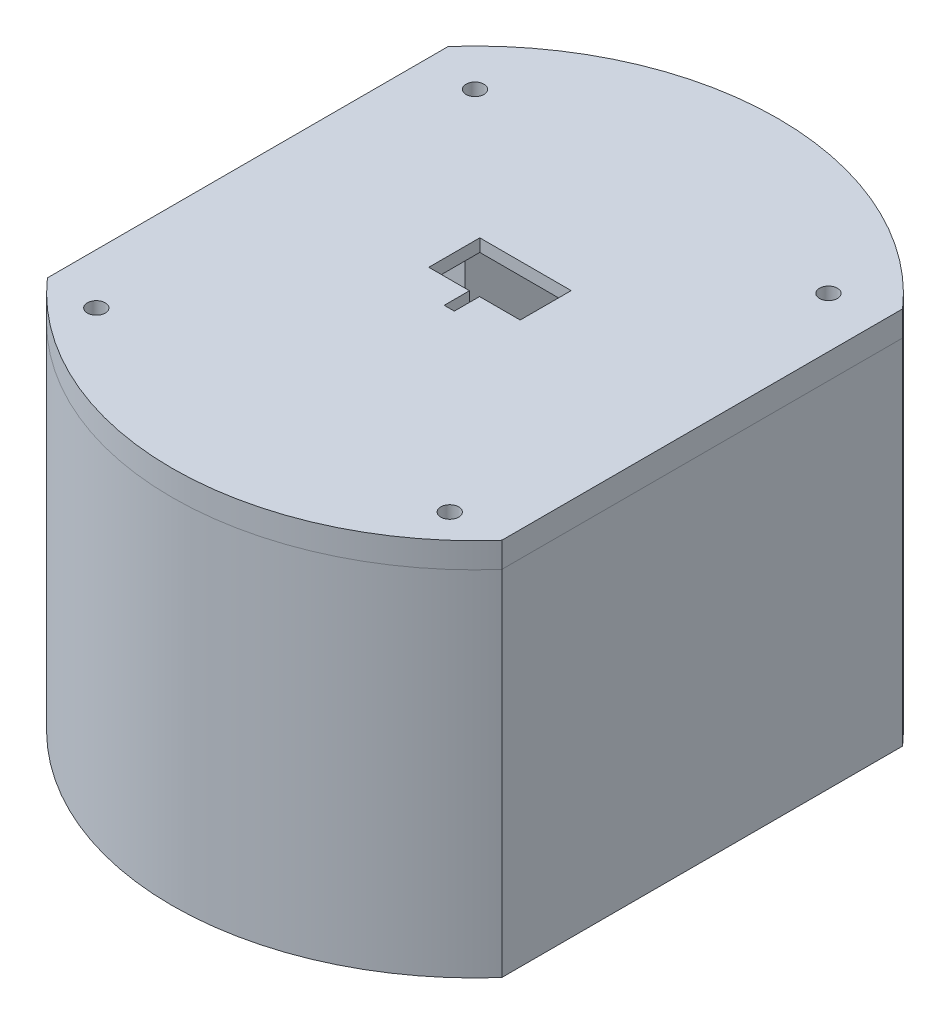
from build123d import *

# Parameters (mm, degrees)
SKETCH1_R                = 76.2
BOSS_EXTRUDE1_DEPTH      = 88.9
CUT_EXTRUDE1_DEPTH       = 38.1
SKETCH3_W                = 81.28
SKETCH3_H                = 87.619747847
CUT_EXTRUDE2_DEPTH       = 71.12
CUT_EXTRUDE4_DEPTH       = 140.7
CUT_EXTRUDE6_REACH       = 132.291
SKETCH6_W                = 100.33
SKETCH6_H                = 82.55
SKETCH7_W                = 9.525
SKETCH7_H                = 15.823137595
CUT_EXTRUDE7_DEPTH       = 13.716
M4_CLEARANCE_HOLE1_D     = 4.5
M4_CLEARANCE_HOLE1_DEPTH = 25.4
M4_CLEARANCE_HOLE1_TIP   = 1.351936393
SKETCH11_R               = 2.25
BOSS_EXTRUDE2_DEPTH      = 6.35
CUT_EXTRUDE8_DEPTH       = 13.716
SKETCH13_W               = 100.33
SKETCH13_H               = 82.55
CUT_EXTRUDE9_DEPTH       = 3.175


with BuildPart() as part:
    # Sketch1 → Boss-Extrude1 (new body)
    with BuildSketch(Plane(origin=(0, 0, 0), x_dir=(1, 0, 0), z_dir=(0, 1, 0))):
        with Locations(Location((0, 0, 0), (0, 0, 270))):
            Circle(SKETCH1_R)
    extrude(amount=BOSS_EXTRUDE1_DEPTH)

    # Sketch2 → Cut-Extrude1 (cut)
    with BuildSketch(Plane(origin=(0, 88.9, 0), x_dir=(1, 0, 0), z_dir=(0, 1, 0))):
        with BuildLine():
            Line((38.1, -58.544107304), (38.1, 58.544107304))
            ThreePointArc((38.1, 58.544107304), (0, 69.85), (-38.1, 58.544107304))
            Line((-38.1, 58.544107304), (-38.1, -58.544107304))
            ThreePointArc((-38.1, -58.544107304), (0, -69.85), (38.1, -58.544107304))
        make_face()
    extrude(amount=-CUT_EXTRUDE1_DEPTH, mode=Mode.SUBTRACT)

    # Sketch3 → Cut-Extrude2 (cut)
    with BuildSketch(Plane.XZ):
        with Locations((0, -20.648099982)):
            Rectangle(SKETCH3_W, SKETCH3_H)
        with BuildLine():
            Line((40.64, -64.457973905), (-40.64, -64.457973905))
            ThreePointArc((-40.64, -64.457973905), (0, -76.2), (40.64, -64.457973905))
        make_face()
    extrude(amount=-CUT_EXTRUDE2_DEPTH, mode=Mode.SUBTRACT)

    # Sketch5 → Cut-Extrude4 (cut, through all)
    with BuildSketch(Plane(origin=(0, 88.9, 0), x_dir=(1, 0, 0), z_dir=(0, 1, 0))):
        with BuildLine():
            Line((-57.15, 50.401562476), (-57.15, -50.401562476))
            ThreePointArc((-57.15, -50.401562476), (-76.2, 0), (-57.15, 50.401562476))
        make_face()
        with BuildLine():
            Line((57.15, 50.401562476), (57.15, -50.401562476))
            ThreePointArc((57.15, -50.401562476), (76.2, 0), (57.15, 50.401562476))
        make_face()
    extrude(amount=-CUT_EXTRUDE4_DEPTH, mode=Mode.SUBTRACT)

    # Cut-Extrude6: up to this face of the body (flat: up to its plane)
    cut_extrude6_end = Plane(part.part.faces().sort_by_distance((0, 50.8, 44.815572864))[0])
    # Sketch6 → Cut-Extrude6 (cut, up to the picked face)
    with BuildSketch(Plane(origin=(0, 88.9, 0), x_dir=(1, 0, 0), z_dir=(0, 1, 0)), mode=Mode.PRIVATE) as cut_extrude6_sk1:
        with Locations((0, -3.175)):
            Rectangle(SKETCH6_W, SKETCH6_H)
    cut_extrude6_tool1 = split(extrude(cut_extrude6_sk1.sketch, amount=-CUT_EXTRUDE6_REACH, mode=Mode.PRIVATE), bisect_by=cut_extrude6_end, keep=Keep.BOTH, mode=Mode.PRIVATE)
    add(cut_extrude6_tool1.solids().sort_by(Axis((0, 88.9, 3.175), (0, -1, 0)))[0], mode=Mode.SUBTRACT)

    # Sketch7 → Cut-Extrude7 (cut)
    with BuildSketch(Plane(origin=(0, 50.8, 0), x_dir=(1, 0, 0), z_dir=(0, 1, 0))):
        with Locations((45.4025, 30.188431203)):
            Rectangle(SKETCH7_W, SKETCH7_H)
    extrude(amount=-CUT_EXTRUDE7_DEPTH, mode=Mode.SUBTRACT)

    # M4 Clearance Hole1
    with Locations(Plane(origin=(0, 88.9, 0), x_dir=(1, 0, 0), z_dir=(0, 1, 0))):
        with Locations((44.45, 44.45), (-44.45, 44.45), (-44.45, -50.8), (44.45, -50.8)):
            Hole(M4_CLEARANCE_HOLE1_D / 2, depth=M4_CLEARANCE_HOLE1_DEPTH)
            with Locations((0, 0, -(M4_CLEARANCE_HOLE1_DEPTH + M4_CLEARANCE_HOLE1_TIP / 2))):  # 118° drill point
                Cone(0, M4_CLEARANCE_HOLE1_D / 2, M4_CLEARANCE_HOLE1_TIP, mode=Mode.SUBTRACT)


with BuildPart() as body_2:
    # Sketch11 → Boss-Extrude2 (new body)
    with BuildSketch(Plane(origin=(0, 88.9, 0), x_dir=(1, 0, 0), z_dir=(0, 1, 0))):
        with BuildLine():
            Line((-57.15, -50.401562476), (-57.15, 50.401562476))
            ThreePointArc((-57.15, 50.401562476), (0, 76.2), (57.15, 50.401562476))
            Line((57.15, 50.401562476), (57.15, -50.401562476))
            ThreePointArc((57.15, -50.401562476), (0, -76.2), (-57.15, -50.401562476))
        make_face()
        with Locations(Location((-44.45, -50.8, 0), (0, 0, 270))):
            Circle(SKETCH11_R, mode=Mode.SUBTRACT)
        with Locations(Location((-44.45, 44.45, 0), (0, 0, 270))):
            Circle(SKETCH11_R, mode=Mode.SUBTRACT)
        with Locations(Location((44.45, 44.45, 0), (0, 0, 270))):
            Circle(SKETCH11_R, mode=Mode.SUBTRACT)
        with Locations(Location((44.45, -50.8, 0), (0, 0, 270))):
            Circle(SKETCH11_R, mode=Mode.SUBTRACT)
    extrude(amount=BOSS_EXTRUDE2_DEPTH)

    # Sketch12 → Cut-Extrude8 (cut)
    with BuildSketch(Plane(origin=(0, 95.25, 0), x_dir=(1, 0, 0), z_dir=(0, 1, 0))):
        Polygon((-11.4935, 12.7), (-11.4935, -0.127), (-1.27, -0.127), (-1.27, -6.477), (1.27, -6.477), (1.27, -0.127), (11.4935, -0.127), (11.4935, 12.7), align=None)
    extrude(amount=-CUT_EXTRUDE8_DEPTH, mode=Mode.SUBTRACT)

    # Sketch13 → Cut-Extrude9 (cut)
    with BuildSketch(Plane.XZ.offset(-88.9)):
        with Locations((0, 3.175)):
            Rectangle(SKETCH13_W, SKETCH13_H)
    extrude(amount=-CUT_EXTRUDE9_DEPTH, mode=Mode.SUBTRACT)


solid = Compound([part.part, body_2.part])
